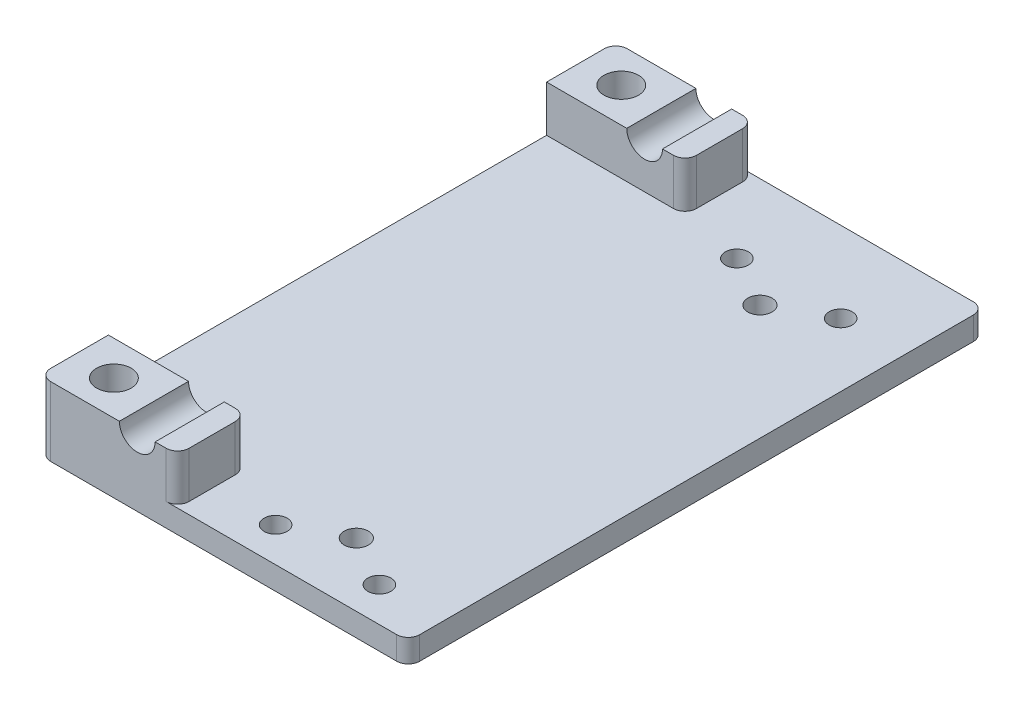
from build123d import *

# Parameters (mm, degrees)
EXTRUDE_1_DEPTH     = 50
SKETCH_2_R          = 1.5
SKETCH_2_R_2        = 1
SKETCH_2_R_3        = 1.05
CUT_EXTRUDE_1_DEPTH = 55.184868737
SKETCH_3_W          = 38
SKETCH_3_H          = 8.212947129
CUT_EXTRUDE_2_DEPTH = 50
FILLET_1_R          = 1


with BuildPart() as part:
    # 草圖1 → 填料-伸長1 (new body)
    with BuildSketch(Plane.XY):
        with BuildLine():
            Line((0, 4), (0, 0))
            Line((0, 0), (20, 0))
            Line((20, 0), (20, -2))
            Line((20, -2), (-12, -2))
            Line((-12, -2), (-12, 4))
            Line((-12, 4), (-5.05, 4))
            ThreePointArc((-5.05, 4), (-3.5, 2.45), (-1.95, 4))
            Line((-1.95, 4), (0, 4))
        make_face()
    extrude(amount=-EXTRUDE_1_DEPTH)

    # 草圖2 → 除料-伸長1 (cut, through all)
    with BuildSketch(Plane(origin=(0, 4, 0), x_dir=(1, 0, 0), z_dir=(0, 1, 0))):
        with Locations(Location((-8.525, 47, 0), (0, 0, 270))):
            Circle(SKETCH_2_R)
        with Locations(Location((-8.525, 3, 0), (0, 0, 270))):
            Circle(SKETCH_2_R)
        with Locations(Location((5.5, 43, 0), (0, 0, 270))):
            Circle(SKETCH_2_R_2)
        with Locations(Location((14.5, 43, 0), (0, 0, 270))):
            Circle(SKETCH_2_R_2)
        with Locations(Location((5.5, 3, 0), (0, 0, 270))):
            Circle(SKETCH_2_R_2)
        with Locations(Location((14.5, 3, 0), (0, 0, 270))):
            Circle(SKETCH_2_R_2)
        with Locations(Location((10, 5.5, 0), (0, 0, 270))):
            Circle(SKETCH_2_R_3)
        with Locations(Location((10, 40.5, 0), (0, 0, 270))):
            Circle(SKETCH_2_R_3)
    extrude(amount=-CUT_EXTRUDE_1_DEPTH, mode=Mode.SUBTRACT)

    # 草圖3 → 除料-伸長2 (cut)
    with BuildSketch(Plane(origin=(0, 0, 0), x_dir=(0, 0, -1), z_dir=(1, 0, 0))):
        with Locations((25, 4.106473564)):
            Rectangle(SKETCH_3_W, SKETCH_3_H)
    extrude(amount=-CUT_EXTRUDE_2_DEPTH, mode=Mode.SUBTRACT)

    # 圓角1
    fillet_1_edges = [part.edges().sort_by_distance(p)[0] for p in [
        (-12, 1, 0),
        (20, -1, -50),
        (0, 2, -50),
        (-12, 1, -50),
        (0, 2, -44),
        (0, 2, -6),
        (0, 2, 0),
        (20, -1, 0),
    ]]
    fillet(fillet_1_edges, radius=FILLET_1_R)


solid = part.part
